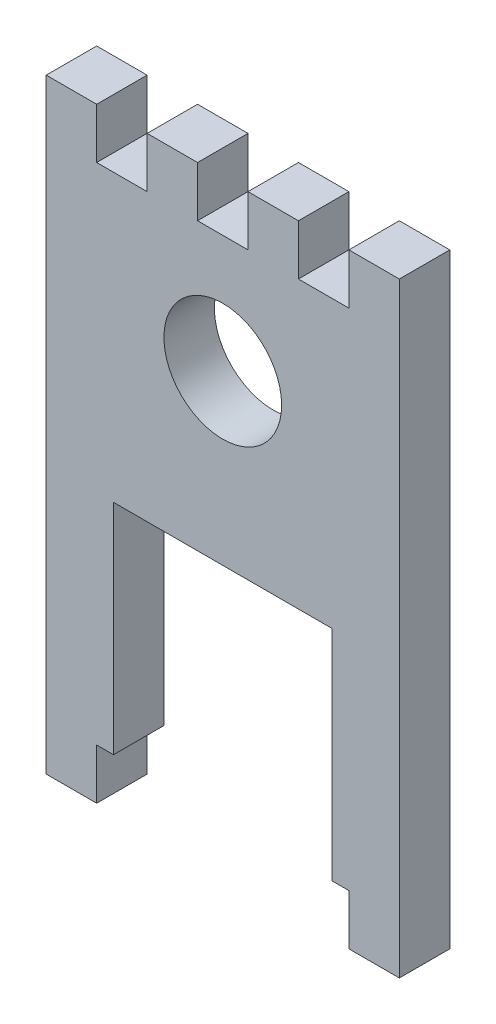
from build123d import *

# Parameters (mm, degrees)
SKETCH2_R           = 3.5
BOSS_EXTRUDE1_DEPTH = 3


with BuildPart() as part:
    # Sketch2 → Boss-Extrude1 (new body)
    with BuildSketch(Plane.XY):
        Polygon((-9.966299499, 13.71), (-6.966299499, 13.71), (-6.966299499, 10.71), (-3.966299499, 10.71), (-3.966299499, 13.71), (-0.966299499, 13.71), (-0.966299499, 10.71), (2.033700501, 10.71), (2.033700501, 13.71), (5.033700501, 13.71), (5.033700501, 10.71), (8.033700501, 10.71), (8.033700501, 13.71), (11.033700501, 13.71), (11.033700501, -22.29), (8.033700501, -22.29), (8.033700501, -19.29), (7.033700501, -19.29), (7.033700501, -6.29), (-5.966299499, -6.29), (-5.966299499, -19.29), (-6.966299499, -19.29), (-6.966299499, -22.29), (-9.966299499, -22.29), align=None)
        with Locations((0.533700501, 3.71)):
            Circle(SKETCH2_R, mode=Mode.SUBTRACT)
    extrude(amount=BOSS_EXTRUDE1_DEPTH)


solid = part.part
